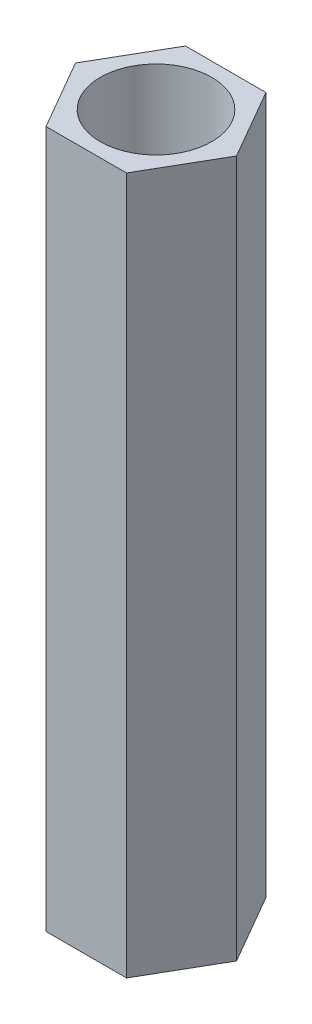
from build123d import *

# Parameters (mm, degrees)
SKETCH_1_R      = 1.6
EXTRUDE_2_DEPTH = 20


with BuildPart() as part:
    # 스케치1 → 보스-돌출2 (new body)
    with BuildSketch(Plane(origin=(0, 0, 0), x_dir=(1, 0, 0), z_dir=(0, 1, 0))):
        Polygon((2.309401077, 0), (1.154700538, 2), (-1.154700538, 2), (-2.309401077, 0), (-1.154700538, -2), (1.154700538, -2), align=None)
        with Locations(Location((0, 0, 0), (0, 0, 270))):
            Circle(SKETCH_1_R, mode=Mode.SUBTRACT)
    extrude(amount=EXTRUDE_2_DEPTH)


solid = part.part
